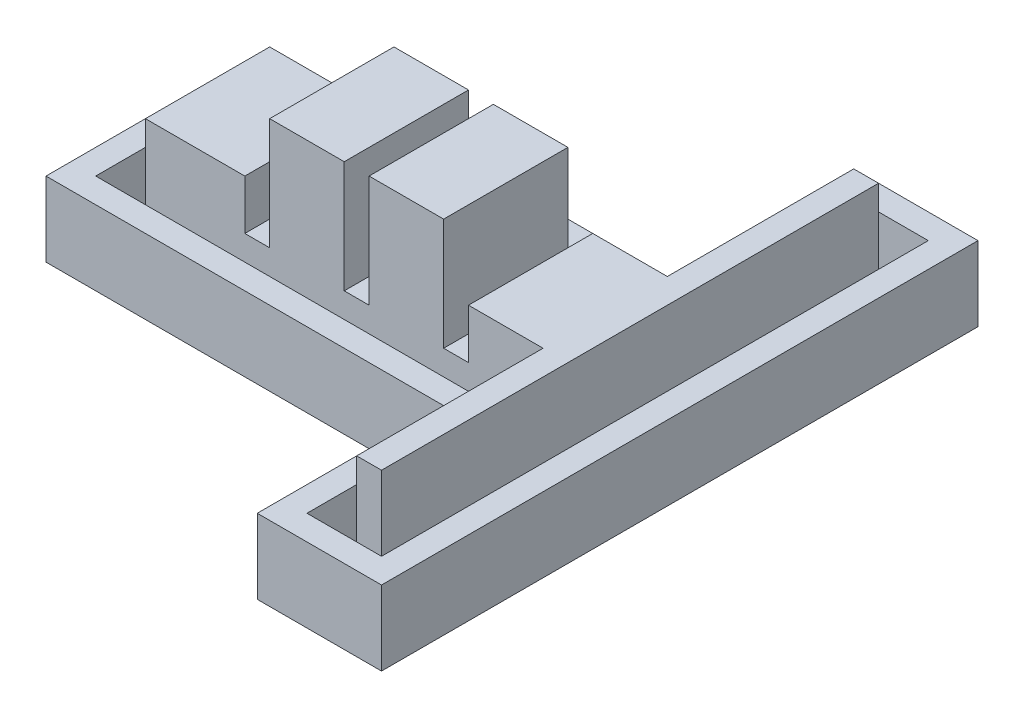
from build123d import *

# Parameters (mm, degrees)
SKETCH1_W            = 6
SKETCH1_H            = 10
BOSS_EXTRUDE1_DEPTH  = 13
SKETCH2_W            = 4
SKETCH2_H            = 6
CUT_EXTRUDE1_DEPTH   = 11
SKETCH3_W            = 10
SKETCH3_H            = 4
BOSS_EXTRUDE2_DEPTH  = 2
LPATTERN1_COUNT      = 2
LPATTERN1_PITCH      = 8
SKETCH18_W           = 10
SKETCH18_H           = 8
BOSS_EXTRUDE3_DEPTH  = 8
SKETCH20_W           = 10
SKETCH20_H           = 4
BOSS_EXTRUDE4_DEPTH  = 2
SKETCH21_W           = 10
SKETCH21_H           = 8
BOSS_EXTRUDE5_DEPTH  = 6
SKETCH22_W           = 40
SKETCH22_H           = 8
BOSS_EXTRUDE6_DEPTH  = 2
SKETCH23_W           = 4
SKETCH23_H           = 6
CUT_EXTRUDE2_DEPTH   = 6
BOSS_EXTRUDE15_DEPTH = 2
BOSS_EXTRUDE16_DEPTH = 6


with BuildPart() as part:
    # Sketch1 → Boss-Extrude1 (new body)
    with BuildSketch(Plane(origin=(0, 0, 0), x_dir=(1, 0, 0), z_dir=(0, 1, 0))):
        with Locations((3, 5)):
            Rectangle(SKETCH1_W, SKETCH1_H)
    extrude(amount=BOSS_EXTRUDE1_DEPTH)

    # Sketch2 → Cut-Extrude1 (cut)
    with BuildSketch(Plane.XZ):
        with Locations((3, -5)):
            Rectangle(SKETCH2_W, SKETCH2_H)
    extrude(amount=-CUT_EXTRUDE1_DEPTH, mode=Mode.SUBTRACT)

    # Sketch3 → Boss-Extrude2 (add)
    with BuildSketch(Plane.ZY):
        with Locations((-5, 2)):
            Rectangle(SKETCH3_W, SKETCH3_H)
    extrude(amount=BOSS_EXTRUDE2_DEPTH)


with BuildPart() as lpattern1_1:
    # LPattern1: pattern copy
    add(part.part.moved(Location(Vector(-1, 0, 0) * (1 * LPATTERN1_PITCH))))

    # Sketch18 → Boss-Extrude3 (add)
    with BuildSketch(Plane.ZY.offset(10)):
        with Locations((-5, 4)):
            Rectangle(SKETCH18_W, SKETCH18_H)
    extrude(amount=BOSS_EXTRUDE3_DEPTH)


with BuildPart() as part_1:
    add(part.part)

    # Sketch20 → Boss-Extrude4 (add)
    with BuildSketch(Plane(origin=(6, 0, 0), x_dir=(0, 0, -1), z_dir=(1, 0, 0))):
        with Locations((5, 2)):
            Rectangle(SKETCH20_W, SKETCH20_H)
    extrude(amount=BOSS_EXTRUDE4_DEPTH)

    # Sketch21 → Boss-Extrude5 (add)
    with BuildSketch(Plane(origin=(8, 0, 0), x_dir=(0, 0, -1), z_dir=(1, 0, 0))):
        with Locations((5, 4)):
            Rectangle(SKETCH21_W, SKETCH21_H)
    extrude(amount=BOSS_EXTRUDE5_DEPTH)

    # Sketch22 → Boss-Extrude6 (add)
    with BuildSketch(Plane(origin=(14, 0, 0), x_dir=(0, 0, -1), z_dir=(1, 0, 0))):
        with Locations((5, 4)):
            Rectangle(SKETCH22_W, SKETCH22_H)
    extrude(amount=BOSS_EXTRUDE6_DEPTH)


with BuildPart() as cut_extrude2_tool:
    # Sketch23 → Cut-Extrude2 (new body)
    with BuildSketch(Plane.XZ):
        with Locations((11, -5)):
            Rectangle(SKETCH23_W, SKETCH23_H)
        with Locations((-13, -5)):
            Rectangle(SKETCH23_W, SKETCH23_H)
    extrude(amount=-CUT_EXTRUDE2_DEPTH)


with BuildPart() as part_2:
    add(part_1.part)

    # Cut-Extrude2: cut by cut_extrude2_tool
    add(cut_extrude2_tool.part, mode=Mode.SUBTRACT)


with BuildPart() as lpattern1_1_1:
    add(lpattern1_1.part)

    # Cut-Extrude2: cut by cut_extrude2_tool
    add(cut_extrude2_tool.part, mode=Mode.SUBTRACT)

    # Combine1: union part
    add(part_2.part)


with BuildPart() as body_2:
    # Sketch33 → Boss-Extrude15 (new body)
    with BuildSketch(Plane.XZ):
        Polygon((12, 2), (-20, 2), (-20, -12), (12, -12), (12, -27), (18, -27), (18, 17), (12, 17), align=None)
    extrude(amount=BOSS_EXTRUDE15_DEPTH)

    # Sketch34 → Boss-Extrude16 (add)
    with BuildSketch(Plane.XZ.offset(2)):
        Polygon((10, 19), (10, 4), (-22, 4), (-22, -14), (10, -14), (10, -29), (20, -29), (20, 19), align=None)
        Polygon((12, 17), (12, 2), (-20, 2), (-20, -12), (12, -12), (12, -27), (18, -27), (18, 17), align=None, mode=Mode.SUBTRACT)
    extrude(amount=-BOSS_EXTRUDE16_DEPTH)


solid = Compound([lpattern1_1_1.part, body_2.part])
